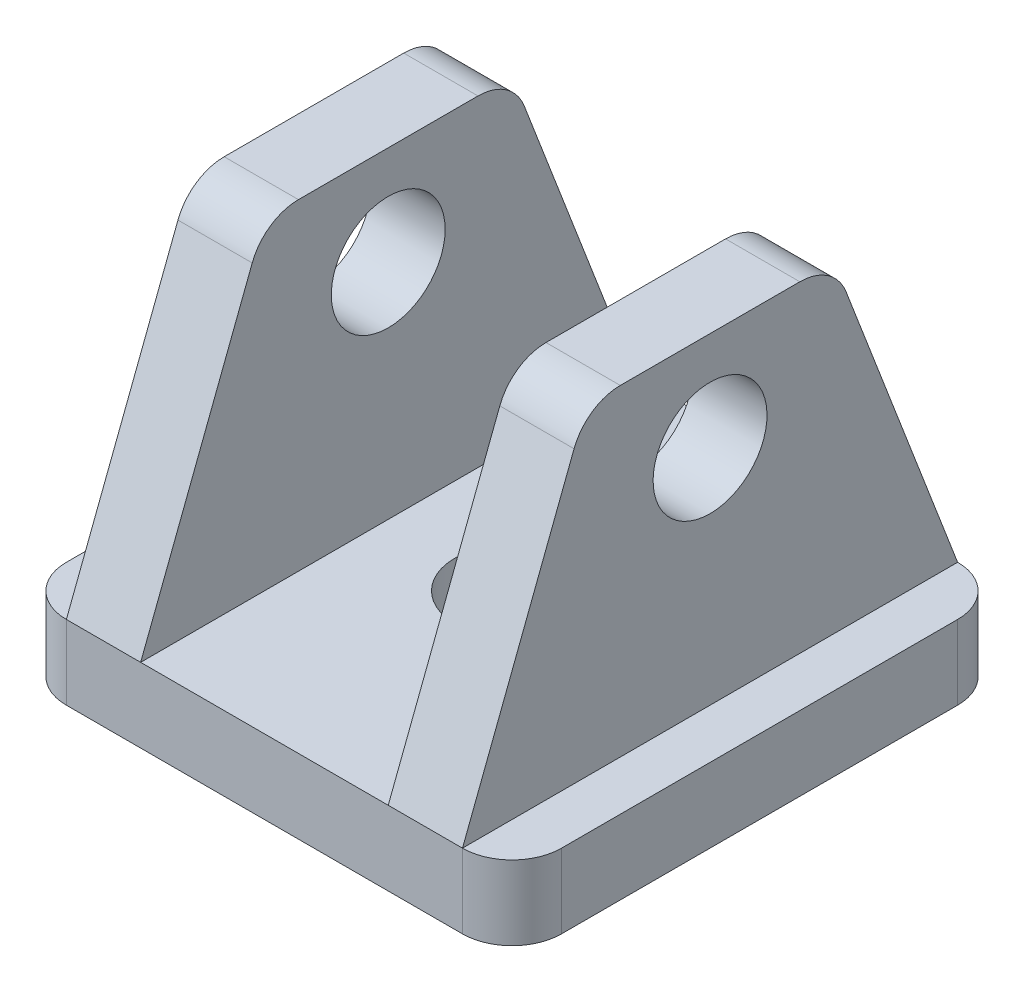
from build123d import *

# Parameters (mm, degrees)
SKETCH1_W           = 25.4
SKETCH1_H           = 25.4
SKETCH1_R           = 2.921
BOSS_EXTRUDE1_DEPTH = 3.81
FILLET1_R           = 2.54
SKETCH4_R           = 2.921
CUT_EXTRUDE1_DEPTH  = 40.757288755
FILLET2_R           = 2.54


with BuildPart() as part:
    # Sketch1 → Boss-Extrude1 (new body)
    with BuildSketch(Plane(origin=(0, 0, 0), x_dir=(1, 0, 0), z_dir=(0, 1, 0))):
        with Locations((12.7, 12.7)):
            Rectangle(SKETCH1_W, SKETCH1_H)
        with Locations(Location((12.7, 12.7, 0), (0, 0, 90))):
            Circle(SKETCH1_R, mode=Mode.SUBTRACT)
    extrude(amount=BOSS_EXTRUDE1_DEPTH)

    # Fillet1
    fillet1_edges = [part.edges().sort_by_distance(p)[0] for p in [
        (0, 1.905, -25.4),
        (25.4, 1.905, -25.4),
        (25.4, 1.905, 0),
        (0, 1.905, 0),
    ]]
    fillet(fillet1_edges, radius=FILLET1_R)

    # Sketch2 → Loft2 section 0
    with BuildSketch(Plane(origin=(0, 3.81, 0), x_dir=(1, 0, 0), z_dir=(0, 1, 0))):
        with BuildLine():
            Line((2.54, 25.4), (6.35, 25.4))
            Line((6.35, 25.4), (6.35, 0))
            Line((6.35, 0), (2.54, 0))
            Line((2.54, 0), (2.54, 25.4))
        make_face()
    # Sketch3 → Loft2 section 1
    with BuildSketch(Plane(origin=(0, 20.32, 0), x_dir=(1, 0, 0), z_dir=(0, 1, 0))):
        with BuildLine():
            Line((2.54, 19.05), (6.35, 19.05))
            Line((6.35, 19.05), (6.35, 6.35))
            Line((6.35, 6.35), (2.54, 6.35))
            Line((2.54, 6.35), (2.54, 19.05))
        make_face()
    loft()

    # Sketch2<3> → Loft3 section 0
    with BuildSketch(Plane(origin=(0, 3.81, 0), x_dir=(1, 0, 0), z_dir=(0, 1, 0))):
        with BuildLine():
            Line((22.86, 25.4), (19.05, 25.4))
            Line((19.05, 25.4), (19.05, 0))
            Line((19.05, 0), (22.86, 0))
            Line((22.86, 0), (22.86, 25.4))
        make_face()
    # Sketch3<3> → Loft3 section 1
    with BuildSketch(Plane(origin=(0, 20.32, 0), x_dir=(1, 0, 0), z_dir=(0, 1, 0))):
        with BuildLine():
            Line((19.05, 19.05), (22.86, 19.05))
            Line((22.86, 19.05), (22.86, 6.35))
            Line((22.86, 6.35), (19.05, 6.35))
            Line((19.05, 6.35), (19.05, 19.05))
        make_face()
    loft()

    # Sketch4 → Cut-Extrude1 (cut, through all)
    with BuildSketch(Plane.ZY.offset(-2.54)):
        with Locations(Location((-12.7, 15.24, 0), (0, 0, 270))):
            Circle(SKETCH4_R)
    extrude(amount=-CUT_EXTRUDE1_DEPTH, mode=Mode.SUBTRACT)

    # Fillet2
    fillet2_edges = [part.edges().sort_by_distance(p)[0] for p in [
        (20.955, 20.32, -6.35),
        (20.955, 20.32, -19.05),
        (4.445, 20.32, -19.05),
        (4.445, 20.32, -6.35),
    ]]
    fillet(fillet2_edges, radius=FILLET2_R)


solid = part.part
